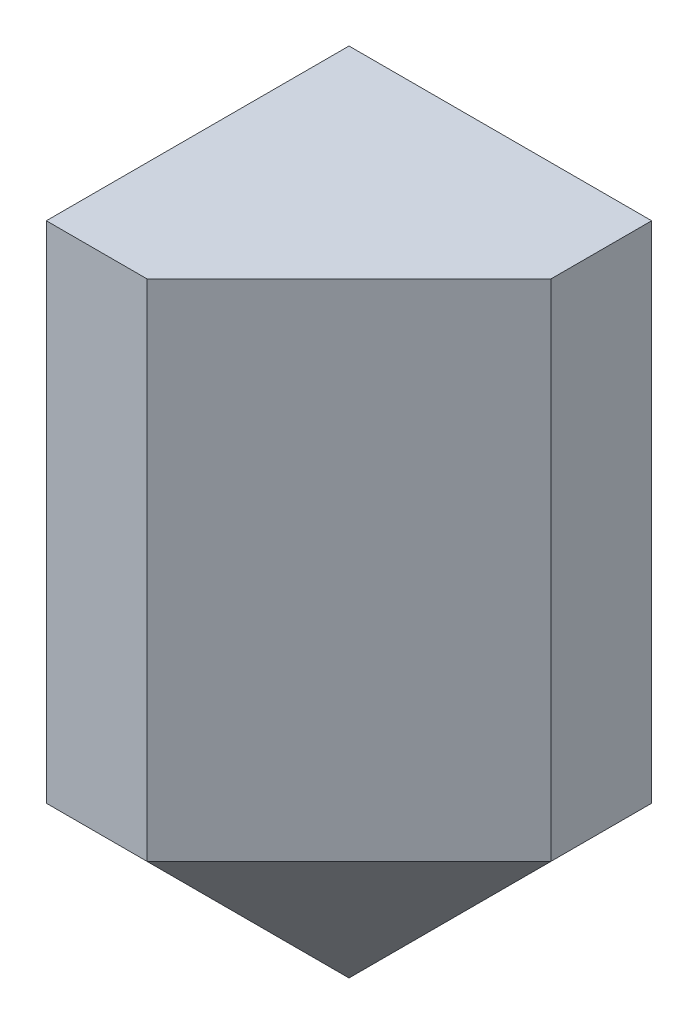
from build123d import *

# Parameters (mm, degrees)
SCHIZZO1_W                   = 30
SCHIZZO1_H                   = 40
ESTRUSIONE_ESTRUSIONE1_DEPTH = 30
SMUSSO1_SIZE                 = 20
ESTRUSIONE_ESTRUSIONE2_DEPTH = 30
FORO_PER_VITE_M5_1_D         = 5.5
FORO_PER_VITE_M5_1_DEPTH     = 15
FORO_PER_VITE_M5_1_TIP       = 1.652366702
FORO_PER_VITE_M5_2_D         = 5.5
FORO_PER_VITE_M5_2_DEPTH     = 15
FORO_PER_VITE_M5_2_TIP       = 1.652366702
SCHIZZO6_R                   = 10
TAGLIO_ESTRUSIONE1_DEPTH     = 2


with BuildPart() as part:
    # Schizzo1 → Estrusione-Estrusione1 (new body)
    with BuildSketch(Plane.XY):
        with Locations((15, 20)):
            Rectangle(SCHIZZO1_W, SCHIZZO1_H)
    extrude(amount=ESTRUSIONE_ESTRUSIONE1_DEPTH)

    # Smusso1
    smusso1_edges = [part.edges().sort_by_distance(p)[0] for p in [
        (30, 20, 30),
        (30, 0, 15),
        (15, 0, 30),
    ]]
    chamfer(smusso1_edges, length=SMUSSO1_SIZE)

    # Schizzo2 → Estrusione-Estrusione2 (add)
    with BuildSketch(Plane(origin=(0, 40, 0), x_dir=(1, 0, 0), z_dir=(0, 1, 0))):
        Polygon((0, 0), (30, 0), (30, -10), (10, -30), (0, -30), align=None)
    extrude(amount=ESTRUSIONE_ESTRUSIONE2_DEPTH)

    # Foro per Vite M5-1
    with Locations(Plane.ZY):
        with Locations((18, 20)):
            Hole(FORO_PER_VITE_M5_1_D / 2, depth=FORO_PER_VITE_M5_1_DEPTH)
            with Locations((0, 0, -(FORO_PER_VITE_M5_1_DEPTH + FORO_PER_VITE_M5_1_TIP / 2))):  # 118° drill point
                Cone(0, FORO_PER_VITE_M5_1_D / 2, FORO_PER_VITE_M5_1_TIP, mode=Mode.SUBTRACT)

    # Foro per Vite M5-2
    with Locations(Plane(origin=(18, 20, 0), x_dir=(-1, 0, 0), z_dir=(0, 0, -1))):
        with Locations((0, 0), (0, 28)):
            Hole(FORO_PER_VITE_M5_2_D / 2, depth=FORO_PER_VITE_M5_2_DEPTH)
            with Locations((0, 0, -(FORO_PER_VITE_M5_2_DEPTH + FORO_PER_VITE_M5_2_TIP / 2))):  # 118° drill point
                Cone(0, FORO_PER_VITE_M5_2_D / 2, FORO_PER_VITE_M5_2_TIP, mode=Mode.SUBTRACT)

    # Schizzo6 → Taglio-Estrusione1 (cut)
    with BuildSketch(Plane.ZY):
        with Locations((15, 55)):
            Circle(SCHIZZO6_R)
    extrude(amount=-TAGLIO_ESTRUSIONE1_DEPTH, mode=Mode.SUBTRACT)


solid = part.part
